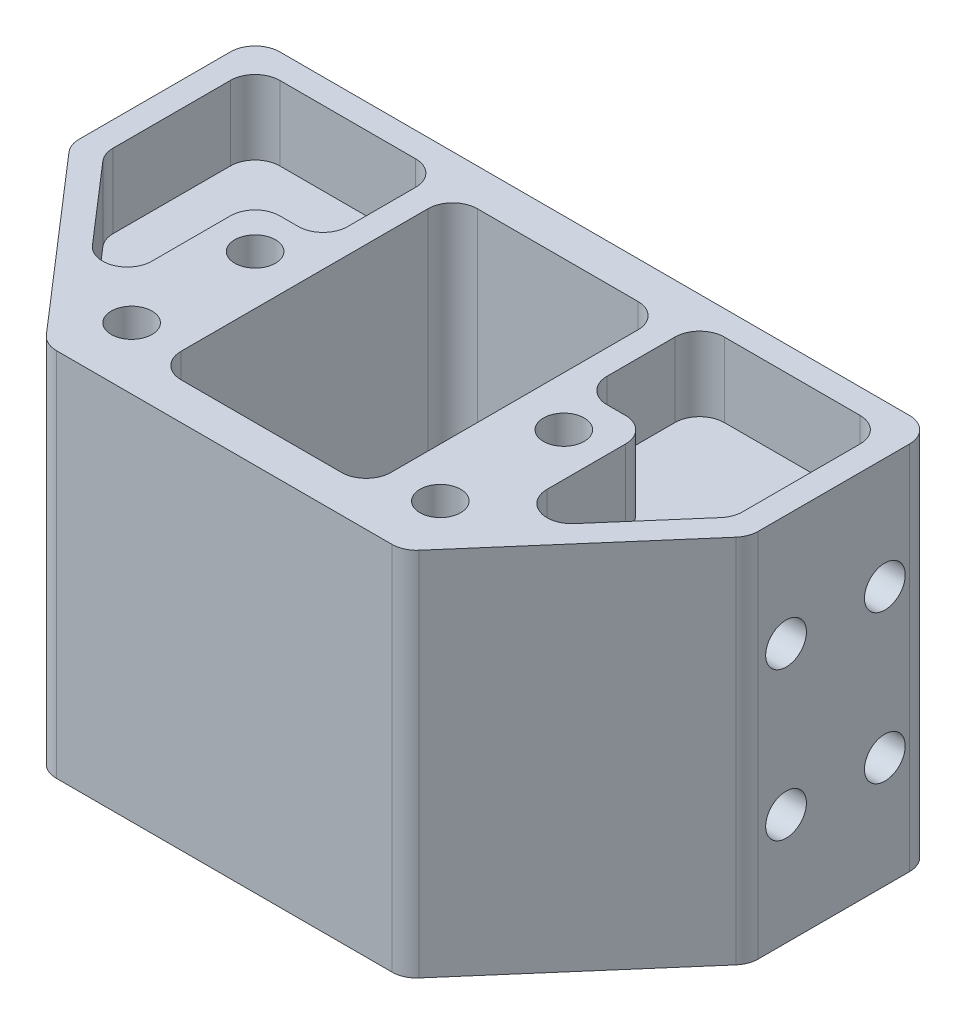
from build123d import *

# Parameters (mm, degrees)
SKETCH_1_W          = 55
SKETCH_1_H          = 30
EXTRUDE_1_DEPTH     = 30
SKETCH_2_R          = 1.65
SKETCH_2_W          = 17
SKETCH_2_H          = 24
CUT_EXTRUDE_1_DEPTH = 40
CUT_EXTRUDE_3_DEPTH = 40
CUT_EXTRUDE_4_DEPTH = 6
CUT_EXTRUDE_5_DEPTH = 6
FILLET_1_R          = 2
FILLET_2_R          = 2
FILLET_3_R          = 2
SKETCH_10_R         = 1.65
CUT_EXTRUDE_7_DEPTH = 8
CUT_EXTRUDE_START   = -8
SKETCH_11_R         = 1.65
CUT_EXTRUDE_8_DEPTH = 8


with BuildPart() as part:
    # 草图1 → 凸台-拉伸1 (new body)
    with BuildSketch(Plane.XY):
        Rectangle(SKETCH_1_W, SKETCH_1_H)
    extrude(amount=EXTRUDE_1_DEPTH)

    # 草图2 → 切除-拉伸1 (cut)
    with BuildSketch(Plane(origin=(0, 15, 0), x_dir=(1, 0, 0), z_dir=(0, 1, 0))):
        with Locations(Location((12.5, -25, 0), (0, 0, 270))):
            Circle(SKETCH_2_R)
        with Locations(Location((-12.5, -25, 0), (0, 0, 270))):
            Circle(SKETCH_2_R)
        with Locations(Location((-12.5, -15, 0), (0, 0, 270))):
            Circle(SKETCH_2_R)
        with Locations(Location((12.5, -15, 0), (0, 0, 270))):
            Circle(SKETCH_2_R)
        with Locations((0, -15)):
            Rectangle(SKETCH_2_W, SKETCH_2_H)
    extrude(amount=-CUT_EXTRUDE_1_DEPTH, mode=Mode.SUBTRACT)

    # 草图7 → 切除-拉伸3 (cut)
    with BuildSketch(Plane(origin=(0, 15, 0), x_dir=(1, 0, 0), z_dir=(0, 1, 0))):
        Polygon((27.5, -15), (27.5, -30), (14.5, -30), align=None)
        Polygon((-14.5, -30), (-27.5, -30), (-27.5, -15), align=None)
    extrude(amount=-CUT_EXTRUDE_3_DEPTH, mode=Mode.SUBTRACT)

    # 草图8 → 切除-拉伸4 (cut)
    with BuildSketch(Plane(origin=(0, 15, 0), x_dir=(1, 0, 0), z_dir=(0, 1, 0))):
        Polygon((-16, -25.215471809), (-16, -11.5), (-10.5, -11.5), (-10.5, -2), (-25.5, -2), (-25.5, -14.253933347), align=None)
        Polygon((16, -25.215471809), (16, -11.5), (10.5, -11.5), (10.5, -2), (25.5, -2), (25.5, -14.253933347), align=None)
    extrude(amount=-CUT_EXTRUDE_4_DEPTH, mode=Mode.SUBTRACT)

    # 草图9 → 切除-拉伸5 (cut)
    with BuildSketch(Plane.XZ.offset(15)):
        Polygon((-16, 25.215471809), (-16, 11.5), (-10.5, 11.5), (-10.5, 2), (-25.5, 2), (-25.5, 14.253933347), align=None)
        Polygon((16.668372364, 24.444272927), (16, 11.5), (10.5, 11.5), (10.5, 2), (25.5, 2), (25.5, 14.253933347), align=None)
    extrude(amount=-CUT_EXTRUDE_5_DEPTH, mode=Mode.SUBTRACT)

    # 圆角1
    fillet_1_edges = [part.edges().sort_by_distance(p)[0] for p in [
        (-25.5, -12, 14.253933347),
        (-16, -12, 25.215471809),
        (-16, -12, 11.5),
        (-10.5, -12, 11.5),
        (-10.5, -12, 2),
        (-25.5, -12, 2),
        (25.5, -12, 2),
        (10.5, -12, 2),
        (10.5, -12, 11.5),
        (16, -12, 11.5),
        (16.668372364, -12, 24.444272927),
        (25.5, -12, 14.253933347),
        (8.5, 0, 3),
        (8.5, 0, 27),
        (-8.5, 0, 27),
        (-8.5, 0, 3),
    ]]
    fillet(fillet_1_edges, radius=FILLET_1_R)

    # 圆角2
    fillet_2_edges = [part.edges().sort_by_distance(p)[0] for p in [
        (25.5, 12, 14.253933347),
        (16, 12, 25.215471809),
        (16, 12, 11.5),
        (10.5, 12, 11.5),
        (10.5, 12, 2),
        (25.5, 12, 2),
        (-16, 12, 25.215471809),
        (-25.5, 12, 14.253933347),
        (-25.5, 12, 2),
        (-10.5, 12, 2),
        (-10.5, 12, 11.5),
        (-16, 12, 11.5),
    ]]
    fillet(fillet_2_edges, radius=FILLET_2_R)

    # 圆角3
    fillet_3_edges = [part.edges().sort_by_distance(p)[0] for p in [
        (-27.5, 0, 0),
        (-14.5, 0, 30),
        (14.5, 0, 30),
        (27.5, 0, 0),
        (27.5, 0, 15),
        (-27.5, 0, 15),
    ]]
    fillet(fillet_3_edges, radius=FILLET_3_R)

    # 草图10 → 切除-拉伸7 (cut)
    with BuildSketch(Plane.ZY.offset(27.5)):
        with Locations(Location((12, -6, 0), (0, 0, 270))):
            Circle(SKETCH_10_R)
        with Locations(Location((4, -6, 0), (0, 0, 270))):
            Circle(SKETCH_10_R)
        with Locations(Location((4, 6, 0), (0, 0, 270))):
            Circle(SKETCH_10_R)
        with Locations(Location((12, 6, 0), (0, 0, 270))):
            Circle(SKETCH_10_R)
    extrude(amount=-CUT_EXTRUDE_7_DEPTH, mode=Mode.SUBTRACT)

    # 草图11 → 切除-拉伸8 (cut)
    with BuildSketch(Plane(origin=(27.5, 0, 0), x_dir=(0, 0, -1), z_dir=(1, 0, 0)).offset(CUT_EXTRUDE_START)):
        with Locations(Location((-12, 6, 0), (0, 0, 270))):
            Circle(SKETCH_11_R)
        with Locations(Location((-4, 6, 0), (0, 0, 270))):
            Circle(SKETCH_11_R)
        with Locations(Location((-4, -6, 0), (0, 0, 270))):
            Circle(SKETCH_11_R)
        with Locations(Location((-12, -6, 0), (0, 0, 270))):
            Circle(SKETCH_11_R)
    extrude(amount=CUT_EXTRUDE_8_DEPTH, mode=Mode.SUBTRACT)


solid = part.part
